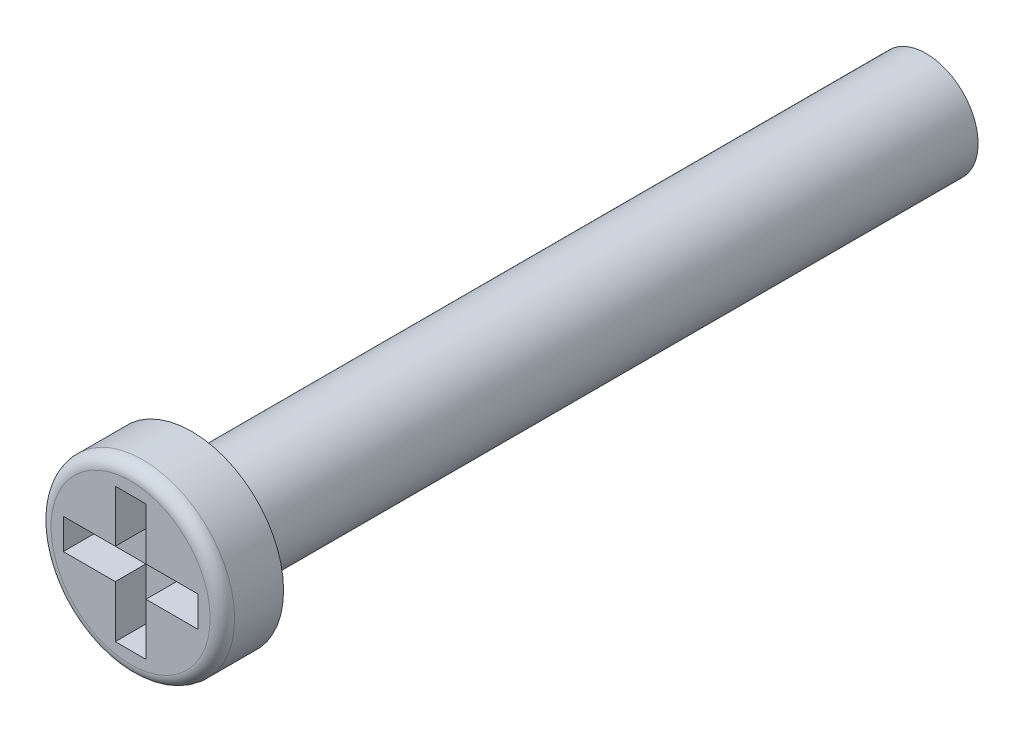
from build123d import *

# Parameters (mm, degrees)
SKETCH1_R           = 1.5
BOSS_EXTRUDE1_DEPTH = 1
SKETCH2_R           = 0.85
BOSS_EXTRUDE2_DEPTH = 12
CUT_EXTRUDE1_DEPTH  = 0.5
FILLET1_R           = 0.2


with BuildPart() as part:
    # Sketch1 → Boss-Extrude1 (new body)
    with BuildSketch(Plane.XY):
        Circle(SKETCH1_R)
    extrude(amount=BOSS_EXTRUDE1_DEPTH)

    # Sketch2 → Boss-Extrude2 (add)
    with BuildSketch(Plane(origin=(0, 0, 0), x_dir=(-1, 0, 0), z_dir=(0, 0, -1))):
        Circle(SKETCH2_R)
    extrude(amount=BOSS_EXTRUDE2_DEPTH)

    # Sketch3 → Cut-Extrude1 (cut)
    with BuildSketch(Plane.XY.offset(1)):
        Polygon((-0.25, 1.1), (-0.25, 0.25), (-1.1, 0.25), (-1.1, -0.25), (-0.25, -0.25), (-0.25, -1.1), (0.25, -1.1), (0.25, -0.25), (1.1, -0.25), (1.1, 0.25), (0.25, 0.25), (0.25, 1.1), align=None)
    extrude(amount=-CUT_EXTRUDE1_DEPTH, mode=Mode.SUBTRACT)

    # Fillet1
    fillet1_edges = [part.edges().sort_by_distance(p)[0] for p in [
        (-1.5, 0, 1),
    ]]
    fillet(fillet1_edges, radius=FILLET1_R)


solid = part.part
